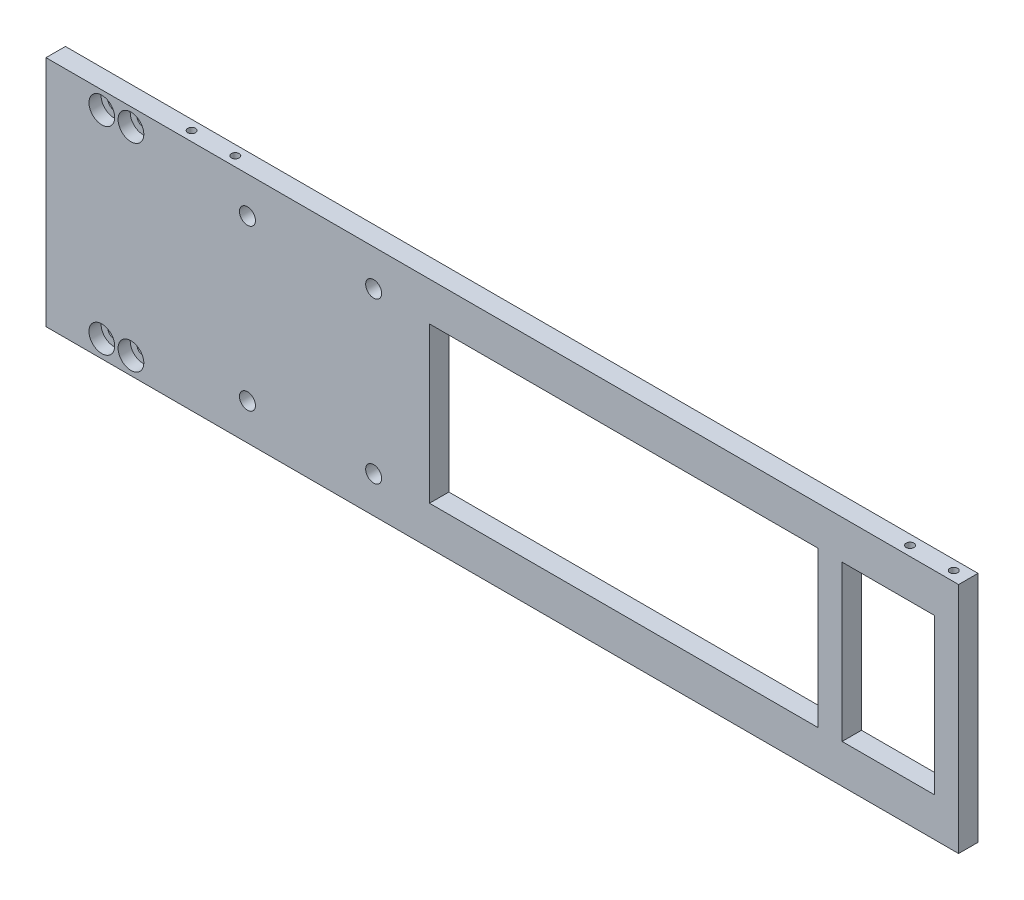
from build123d import *

# Parameters (mm, degrees)
SKETCH1_W                  = 188
SKETCH1_H                  = 48
BOSS_EXTRUDE1_DEPTH        = 4
SKETCH2_R                  = 1.25
CUT_EXTRUDE1_DEPTH         = 4
CUT_EXTRUDE2_START         = -1.5
SKETCH3_R                  = 2.65
CUT_EXTRUDE2_DEPTH         = 10
M2_TAPPED_HOLE1_AT_2_COUNT = 2
M2_TAPPED_HOLE1_AT_2_PITCH = 9
M2_TAPPED_HOLE1_AT_3_COUNT = 2
M2_TAPPED_HOLE1_AT_3_PITCH = 148
M2_TAPPED_HOLE1_AT_4_COUNT = 2
M2_TAPPED_HOLE1_AT_4_PITCH = 157
CUT_EXTRUDE4_DEPTH         = 98.097888752
CUT_EXTRUDE4_DEPTH_BACK    = 4
SKETCH8_W                  = 19
SKETCH8_H                  = 32
SKETCH9_W                  = 80
SKETCH9_H                  = 32
CUT_EXTRUDE5_DEPTH         = 4
M4_TAPPED_HOLE1_D          = 3.3


with BuildPart() as part:
    # Sketch1 → Boss-Extrude1 (new body)
    with BuildSketch(Plane.XY):
        Rectangle(SKETCH1_W, SKETCH1_H)
    extrude(amount=BOSS_EXTRUDE1_DEPTH)

    # Sketch2 → Cut-Extrude1 (cut)
    with BuildSketch(Plane(origin=(0, 0, 0), x_dir=(-1, 0, 0), z_dir=(0, 0, -1))):
        with Locations((76.5, -20.4)):
            Circle(SKETCH2_R)
        with Locations((82.5, -20.4)):
            Circle(SKETCH2_R)
    cut_extrude1 = extrude(amount=-CUT_EXTRUDE1_DEPTH, mode=Mode.SUBTRACT)

    # Sketch3 → Cut-Extrude2 (cut)
    with BuildSketch(Plane(origin=(0, 0, 0), x_dir=(-1, 0, 0), z_dir=(0, 0, -1)).offset(CUT_EXTRUDE2_START)):
        with Locations((76.5, -20.4)):
            Circle(SKETCH3_R)
        with Locations((82.5, -20.4)):
            Circle(SKETCH3_R)
    cut_extrude2 = extrude(amount=-CUT_EXTRUDE2_DEPTH, mode=Mode.SUBTRACT)

    # Mirror1: Cut-Extrude1, Cut-Extrude2 across plane
    add(cut_extrude1.mirror(Plane(origin=(0, 0, 0), x_dir=(0, 0, 1), z_dir=(0, -1, 0))), mode=Mode.SUBTRACT)
    add(cut_extrude2.mirror(Plane(origin=(0, 0, 0), x_dir=(0, 0, 1), z_dir=(0, -1, 0))), mode=Mode.SUBTRACT)

    # Sketch7 → M2 Tapped Hole1 (revolve, cut)
    with BuildSketch(Plane(origin=(-66, 24, 2), x_dir=(0, 0, 1), z_dir=(1, 0, 0))):
        Polygon((0, 0), (0, 6.480688495), (0.8, 6), (0.8, 0), align=None)
    m2_tapped_hole1 = revolve(axis=Axis((-66, 30.35, 2), (0, -1, 0)), mode=Mode.SUBTRACT)

    # M2 Tapped Hole1 at 2: M2 Tapped Hole1 ×2
    with Locations(*[(i * M2_TAPPED_HOLE1_AT_2_PITCH, 0, 0) for i in range(1, M2_TAPPED_HOLE1_AT_2_COUNT)]):
        add(m2_tapped_hole1, mode=Mode.SUBTRACT)

    # M2 Tapped Hole1 at 3: M2 Tapped Hole1 ×2
    with Locations(*[(i * M2_TAPPED_HOLE1_AT_3_PITCH, 0, 0) for i in range(1, M2_TAPPED_HOLE1_AT_3_COUNT)]):
        add(m2_tapped_hole1, mode=Mode.SUBTRACT)

    # M2 Tapped Hole1 at 4: M2 Tapped Hole1 ×2
    with Locations(*[(i * M2_TAPPED_HOLE1_AT_4_PITCH, 0, 0) for i in range(1, M2_TAPPED_HOLE1_AT_4_COUNT)]):
        add(m2_tapped_hole1, mode=Mode.SUBTRACT)

    # Mirror3: M2 Tapped Hole1 across plane
    add(m2_tapped_hole1.mirror(Plane.ZX), mode=Mode.SUBTRACT)

    # Mirror3 copy 1 sketch → Mirror3 copy 1 (revolve, cut)
    with BuildSketch(Plane(origin=(-57, -24, 2), x_dir=(0, 0, 1), z_dir=(1, 0, 0))):
        Polygon((0, 0), (0, -6.480688495), (0.8, -6), (0.8, 0), align=None)
    revolve(axis=Axis((-57, -30.35, 2), (0, -1, 0)), mode=Mode.SUBTRACT)

    # Mirror3 copy 2 sketch → Mirror3 copy 2 (revolve, cut)
    with BuildSketch(Plane(origin=(82, -24, 2), x_dir=(0, 0, 1), z_dir=(1, 0, 0))):
        Polygon((0, 0), (0, -6.480688495), (0.8, -6), (0.8, 0), align=None)
    revolve(axis=Axis((82, -30.35, 2), (0, -1, 0)), mode=Mode.SUBTRACT)

    # Mirror3 copy 3 sketch → Mirror3 copy 3 (revolve, cut)
    with BuildSketch(Plane(origin=(91, -24, 2), x_dir=(0, 0, 1), z_dir=(1, 0, 0))):
        Polygon((0, 0), (0, -6.480688495), (0.8, -6), (0.8, 0), align=None)
    revolve(axis=Axis((91, -30.35, 2), (0, -1, 0)), mode=Mode.SUBTRACT)

    # Sketch8 → Cut-Extrude4 (cut, two sides: drawn at the far end of the back side and taken through both)
    with BuildSketch(Plane.XY.offset(4).offset(-CUT_EXTRUDE4_DEPTH_BACK)):
        with Locations((79.5, 0)):
            Rectangle(SKETCH8_W, SKETCH8_H)
    extrude(amount=CUT_EXTRUDE4_DEPTH + CUT_EXTRUDE4_DEPTH_BACK, mode=Mode.SUBTRACT)

    # Sketch9 → Cut-Extrude5 (cut)
    with BuildSketch(Plane.XY.offset(4)):
        with Locations((25, 0)):
            Rectangle(SKETCH9_W, SKETCH9_H)
    extrude(amount=-CUT_EXTRUDE5_DEPTH, mode=Mode.SUBTRACT)

    # M4 Tapped Hole1 (through all)
    with Locations(Plane.XY.offset(4)):
        with Locations((-52.5, 16.5), (-26.5, 16.5), (-26.5, -16.5), (-52.5, -16.5)):
            Hole(M4_TAPPED_HOLE1_D / 2)


solid = part.part
